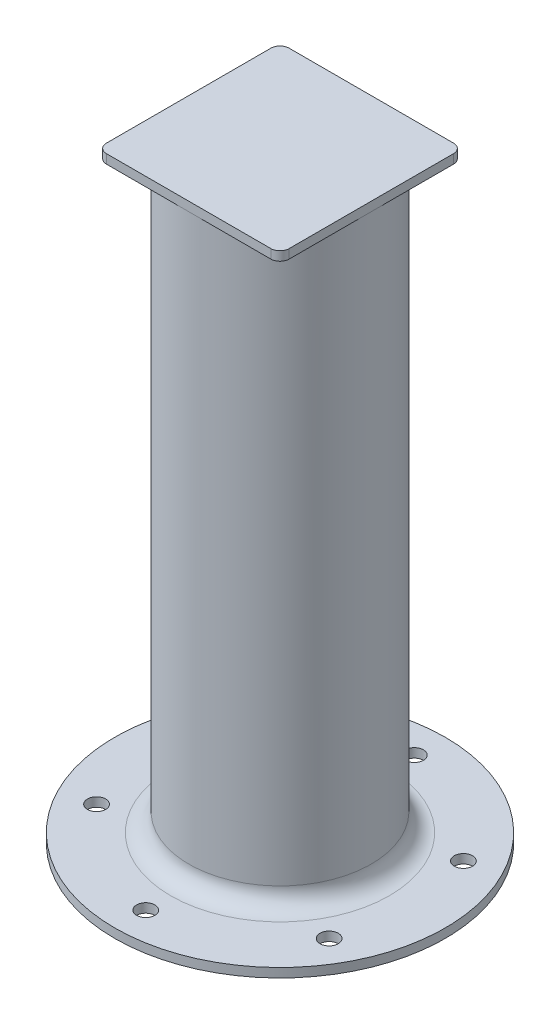
from build123d import *

# Parameters (mm, degrees)
SKETCH1_R           = 100
BOSS_EXTRUDE1_DEPTH = 325
SKETCH2_R           = 181.25545507
SKETCH2_R_2         = 10
BOSS_EXTRUDE2_DEPTH = 5
FILLET1_R           = 20
BOSS_EXTRUDE3_DEPTH = 5


with BuildPart() as part:
    # Sketch1 → Boss-Extrude1 (new, symmetric)
    with BuildSketch(Plane(origin=(0, 0, 0), x_dir=(1, 0, 0), z_dir=(0, 1, 0))):
        with Locations(Location((0, 0, 0), (0, 0, 270))):
            Circle(SKETCH1_R)
    extrude(amount=BOSS_EXTRUDE1_DEPTH, both=True)

    # Sketch2 → Boss-Extrude2 (add, symmetric)
    with BuildSketch(Plane.XZ.offset(325)):
        with Locations(Location((0, 0, 0), (0, 0, 270))):
            Circle(SKETCH2_R)
        with Locations(Location((0, 147.291814794, 0), (0, 0, 270))):
            Circle(SKETCH2_R_2, mode=Mode.SUBTRACT)
        with Locations(Location((127.558453381, 73.645907397, 0), (0, 0, 270))):
            Circle(SKETCH2_R_2, mode=Mode.SUBTRACT)
        with Locations(Location((127.558453381, -73.645907397, 0), (0, 0, 270))):
            Circle(SKETCH2_R_2, mode=Mode.SUBTRACT)
        with Locations(Location((0, -147.291814794, 0), (0, 0, 270))):
            Circle(SKETCH2_R_2, mode=Mode.SUBTRACT)
        with Locations(Location((-127.558453381, -73.645907397, 0), (0, 0, 270))):
            Circle(SKETCH2_R_2, mode=Mode.SUBTRACT)
        with Locations(Location((-127.558453381, 73.645907397, 0), (0, 0, 270))):
            Circle(SKETCH2_R_2, mode=Mode.SUBTRACT)
    extrude(amount=BOSS_EXTRUDE2_DEPTH, both=True)

    # Fillet1
    fillet1_edges = [part.edges().sort_by_distance(p)[0] for p in [
        (0, -320, -100),
    ]]
    fillet(fillet1_edges, radius=FILLET1_R)

    # Sketch3 → Boss-Extrude3 (add, symmetric)
    with BuildSketch(Plane(origin=(0, 325, 0), x_dir=(1, 0, 0), z_dir=(0, 1, 0))):
        with BuildLine():
            Line((-90.193970518, -100.193970518), (90.193970518, -100.193970518))
            ThreePointArc((90.193970518, -100.193970518), (97.265038329, -97.265038329), (100.193970518, -90.193970518))
            Line((100.193970518, -90.193970518), (100.193970518, 90.193970518))
            ThreePointArc((100.193970518, 90.193970518), (97.265038329, 97.265038329), (90.193970518, 100.193970518))
            Line((90.193970518, 100.193970518), (-90.193970518, 100.193970518))
            ThreePointArc((-90.193970518, 100.193970518), (-97.265038329, 97.265038329), (-100.193970518, 90.193970518))
            Line((-100.193970518, 90.193970518), (-100.193970518, -90.193970518))
            ThreePointArc((-100.193970518, -90.193970518), (-97.265038329, -97.265038329), (-90.193970518, -100.193970518))
        make_face()
    extrude(amount=BOSS_EXTRUDE3_DEPTH, both=True)


solid = part.part
